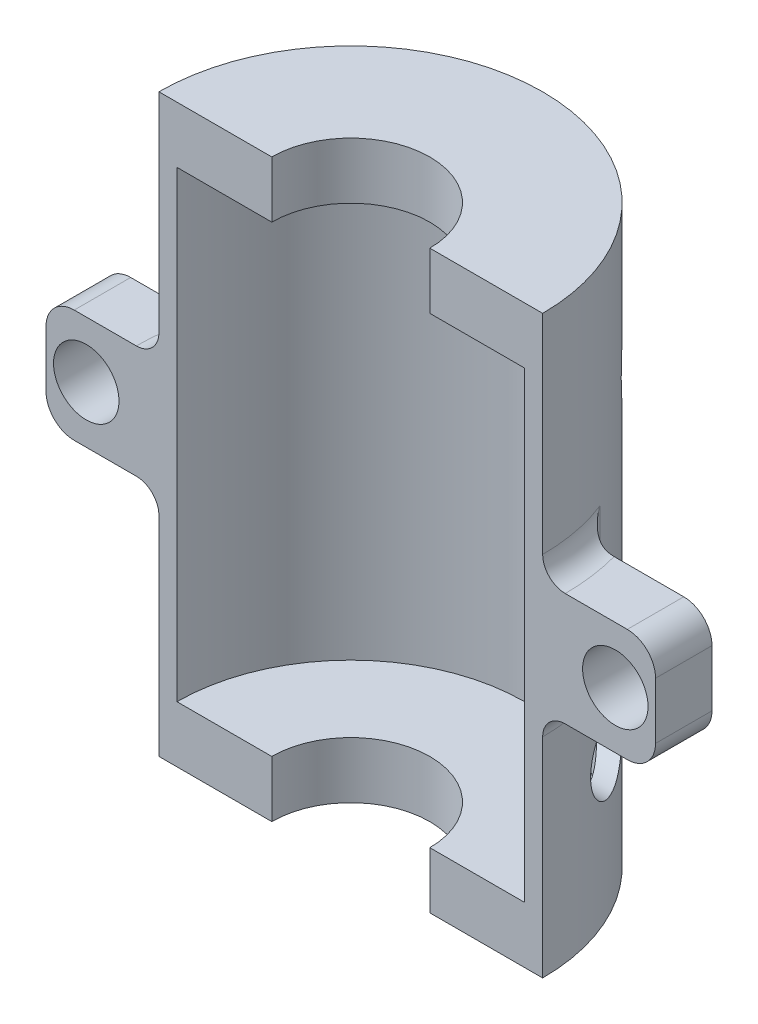
from build123d import *

# Parameters (mm, degrees)
BOSS_EXTRUDE1_DEPTH  = 20.5
BOSS_EXTRUDE2_START  = 5
BOSS_EXTRUDE2_DEPTH  = 5
BOSS_EXTRUDE3_DEPTH  = 5
FILLET1_R            = 2
SKETCH8_R            = 2.9
CUT_EXTRUDE4_DEPTH   = 5
FILLET1_OF_MIRROR3_R = 2
FILLET2_R            = 2.5
SKETCH9_R            = 3.5
CUT_EXTRUDE5_DEPTH   = 50
SKETCH17_R           = 4
CUT_EXTRUDE8_DEPTH   = 50


with BuildPart() as part:
    # Sketch1 → Boss-Extrude1 (new, symmetric)
    with BuildSketch(Plane(origin=(0, 0, 0), x_dir=(1, 0, 0), z_dir=(0, 1, 0))):
        with BuildLine():
            Line((-15.4, 0), (-17, 0))
            ThreePointArc((-17, 0), (0, 17), (17, 0))
            Line((17, 0), (15.4, 0))
            ThreePointArc((15.4, 0), (0, 15.4), (-15.4, 0))
        make_face()
    extrude(amount=BOSS_EXTRUDE1_DEPTH, both=True)

    # Sketch6 → Boss-Extrude2 (add)
    with BuildSketch(Plane(origin=(0, 20.5, 0), x_dir=(1, 0, 0), z_dir=(0, 1, 0)).offset(BOSS_EXTRUDE2_START)):
        with BuildLine():
            Line((-17, 0), (-7, 0))
            ThreePointArc((-7, 0), (0, 7), (7, 0))
            Line((7, 0), (17, 0))
            ThreePointArc((17, 0), (0, 17), (-17, 0))
        make_face()
    boss_extrude2 = extrude(amount=-BOSS_EXTRUDE2_DEPTH)

    # Mirror1: Boss-Extrude2 across plane
    add(boss_extrude2.mirror(Plane.ZX))

    # Sketch7 → Boss-Extrude3 (add, symmetric)
    with BuildSketch(Plane(origin=(0, 0, 0), x_dir=(1, 0, 0), z_dir=(0, 1, 0))):
        with BuildLine():
            Line((-17, 0), (-27, 0))
            Line((-27, 0), (-27, 5))
            Line((-27, 5), (-16.248076809, 5))
            ThreePointArc((-16.248076809, 5), (-16.810968231, 2.528111374), (-17, 0))
        make_face()
    boss_extrude3 = extrude(amount=BOSS_EXTRUDE3_DEPTH, both=True)

    # Fillet1
    fillet1_edges = [part.edges().sort_by_distance(p)[0] for p in [
        (-16.810968231, -5, -2.528111374),
        (-16.248076809, 0, -5),
        (-16.810968231, 5, -2.528111374),
    ]]
    fillet(fillet1_edges, radius=FILLET1_R)

    # Sketch8 → Cut-Extrude4 (cut, symmetric)
    with BuildSketch(Plane(origin=(0, 0, -5), x_dir=(-1, 0, 0), z_dir=(0, 0, -1))):
        with Locations((23.436686237, 0)):
            Circle(SKETCH8_R)
    cut_extrude4 = extrude(amount=CUT_EXTRUDE4_DEPTH, both=True, mode=Mode.SUBTRACT)

    # Mirror3: Boss-Extrude3, Cut-Extrude4 across plane
    add(boss_extrude3.mirror(Plane(origin=(0, 0, 0), x_dir=(0, 0, 1), z_dir=(1, 0, 0))))
    add(cut_extrude4.mirror(Plane(origin=(0, 0, 0), x_dir=(0, 0, 1), z_dir=(1, 0, 0))), mode=Mode.SUBTRACT)

    # Fillet1 of Mirror3
    fillet1_of_mirror3_edges = [part.edges().sort_by_distance(p)[0] for p in [
        (16.810968231, -5, -2.528111374),
        (16.248076809, 0, -5),
        (16.810968231, 5, -2.528111374),
    ]]
    fillet(fillet1_of_mirror3_edges, radius=FILLET1_OF_MIRROR3_R)

    # Fillet2
    fillet2_edges = [part.edges().sort_by_distance(p)[0] for p in [
        (-27, -5, -2.5),
        (-27, 5, -2.5),
        (27, 5, -2.5),
        (27, -5, -2.5),
    ]]
    fillet(fillet2_edges, radius=FILLET2_R)

    # Sketch9 → Cut-Extrude5 (cut)
    with BuildSketch(Plane(origin=(0, 0, 0), x_dir=(0, 0, -1), z_dir=(1, 0, 0))):
        with Locations(Location((8.5, -13, 0), (0, 0, 180))):
            Circle(SKETCH9_R)
    extrude(amount=CUT_EXTRUDE5_DEPTH, mode=Mode.SUBTRACT)

    # Sketch17 → Cut-Extrude8 (cut)
    with BuildSketch(Plane(origin=(0, 0, 0), x_dir=(0, -1, 0), z_dir=(-0.5000000000000011, 0, 0.8660254037844379))):
        with Locations(Location((-13, 1.722431864, 0), (0, 0, 90))):
            Circle(SKETCH17_R)
    extrude(amount=-CUT_EXTRUDE8_DEPTH, mode=Mode.SUBTRACT)


solid = part.part
